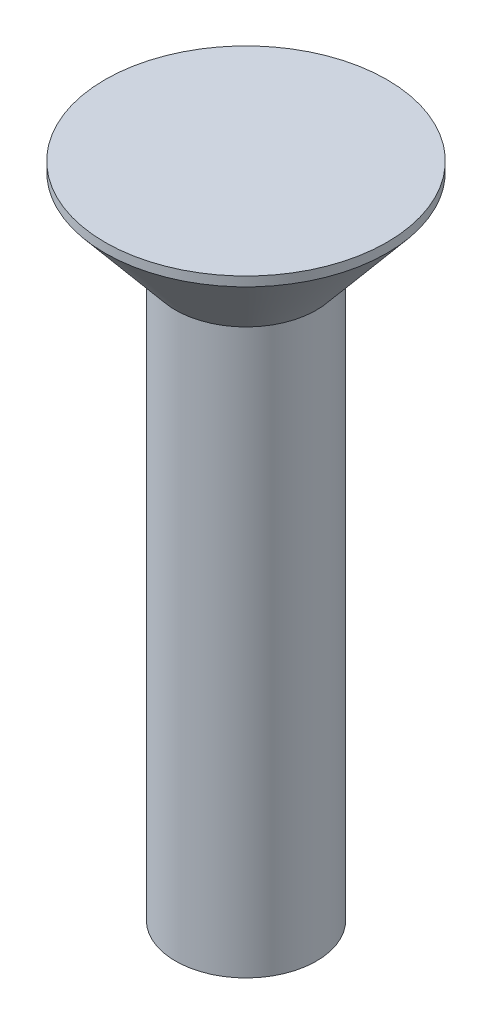
from build123d import *


with BuildPart() as part:
    # 草图2 → 旋转1 (revolve)
    with BuildSketch(Plane.XY, mode=Mode.PRIVATE) as revolve_1_sk:
        Polygon((0, 0), (3, 0), (3, -0.2), (1.5, -2), (1.5, -14), (0, -14), align=None)
    revolve(revolve_1_sk.sketch.rotate(Axis((0, -14, 0), (0, 1, 0)), 90), axis=Axis((0, -14, 0), (0, 1, 0)))


solid = part.part
